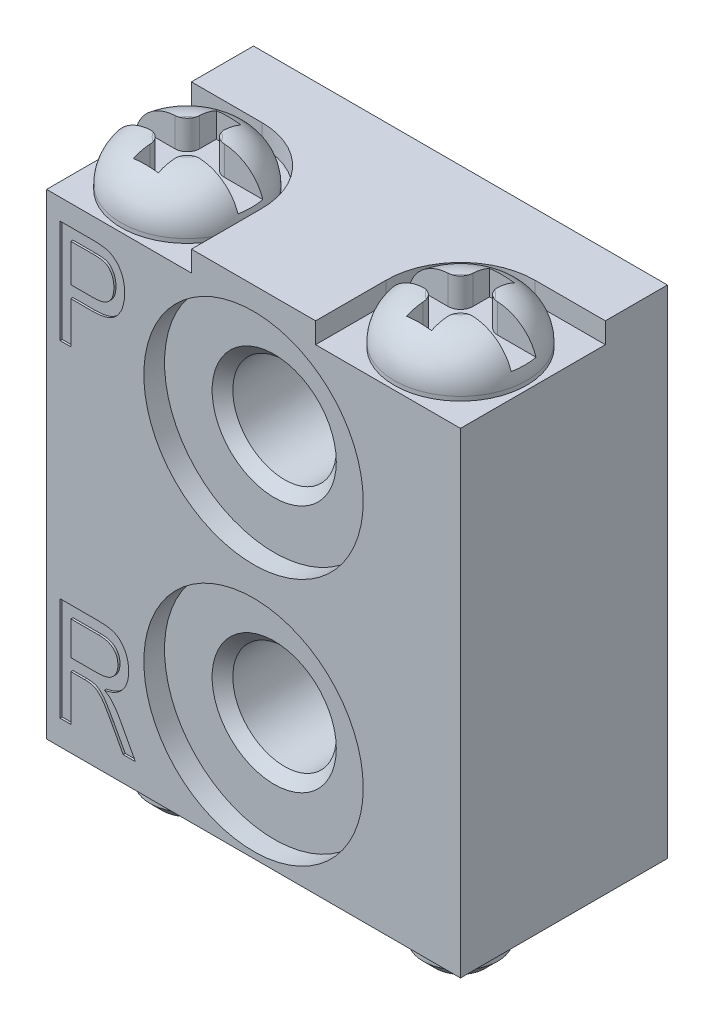
from build123d import *

# Parameters (mm, degrees)
SKETCH1_W                             = 10
SKETCH1_H                             = 12
BOSS_EXTRUDE1_DEPTH                   = 2.5
CUT_EXTRUDE1_DEPTH                    = 0.5
SKETCH3_R                             = 1.6
BOSS_EXTRUDE2_DEPTH                   = 1.1
FILLET1_R                             = 1
CUT_EXTRUDE2_DEPTH                    = 0.7
SKETCH5_R                             = 0.9
BOSS_EXTRUDE3_DEPTH                   = 1.2
CHAMFER1_SIZE                         = 0.3
SKETCH6_R                             = 2.65
CUT_EXTRUDE3_DEPTH                    = 0.5
TAP_DRILL_FOR_M3X0_5_TAP1_D           = 2.5
TAP_DRILL_FOR_M3X0_5_TAP1_DEPTH       = 3
TAP_DRILL_FOR_M3X0_5_TAP1_CSINK_D     = 3
TAP_DRILL_FOR_M3X0_5_TAP1_CSINK_ANGLE = 90
TAP_DRILL_FOR_M3X0_5_TAP1_TIP         = 0.751075774
CUT_EXTRUDE4_DEPTH                    = 0.05
SKETCH10_R                            = 0.85
CUT_EXTRUDE5_DEPTH                    = 1.5


with BuildPart() as part:
    # Sketch1 → Boss-Extrude1 (new, symmetric)
    with BuildSketch(Plane.XY):
        Rectangle(SKETCH1_W, SKETCH1_H)
    extrude(amount=BOSS_EXTRUDE1_DEPTH, both=True)

    # Sketch2 → Cut-Extrude1 (cut)
    with BuildSketch(Plane(origin=(0, 6, 0), x_dir=(1, 0, 0), z_dir=(0, 1, 0))):
        with BuildLine():
            Line((-5, -2.5), (-1.5, -2.5))
            Line((-1.5, -2.5), (-1.5, -0.8))
            ThreePointArc((-1.5, -0.8), (-2.027207794, 0.472792206), (-3.3, 1))
            Line((-3.3, 1), (-5, 1))
            Line((-5, 1), (-5, -2.5))
        make_face()
        with BuildLine():
            Line((5, -2.5), (1.5, -2.5))
            Line((1.5, -2.5), (1.5, -0.8))
            ThreePointArc((1.5, -0.8), (2.027207794, 0.472792206), (3.3, 1))
            Line((3.3, 1), (5, 1))
            Line((5, 1), (5, -2.5))
        make_face()
    extrude(amount=-CUT_EXTRUDE1_DEPTH, mode=Mode.SUBTRACT)

    # Sketch3 → Boss-Extrude2 (add)
    with BuildSketch(Plane(origin=(0, 5.5, 0), x_dir=(1, 0, 0), z_dir=(0, 1, 0))):
        with Locations(Location((-3.3, -0.8, 0), (0, 0, 90))):
            Circle(SKETCH3_R)
        with Locations(Location((3.3, -0.8, 0), (0, 0, 270))):
            Circle(SKETCH3_R)
    extrude(amount=BOSS_EXTRUDE2_DEPTH)

    # Fillet1
    fillet1_edges = [part.edges().sort_by_distance(p)[0] for p in [
        (-3.3, 6.6, 2.4),
        (3.3, 6.6, -0.8),
    ]]
    fillet(fillet1_edges, radius=FILLET1_R)

    # Sketch4 → Cut-Extrude2 (cut)
    with BuildSketch(Plane(origin=(0, 6.6, 0), x_dir=(1, 0, 0), z_dir=(0, 1, 0))):
        with BuildLine():
            Line((-2.7, -0.5), (-1.7, -0.5))
            Line((-1.7, -0.5), (-1.7, -1.1))
            Line((-1.7, -1.1), (-2.7, -1.1))
            ThreePointArc((-2.7, -1.1), (-2.912132034, -1.187867966), (-3, -1.4))
            Line((-3, -1.4), (-3, -1.8))
            Line((-3, -1.8), (-3.6, -1.8))
            Line((-3.6, -1.8), (-3.6, -1.4))
            ThreePointArc((-3.6, -1.4), (-3.687867966, -1.187867966), (-3.9, -1.1))
            Line((-3.9, -1.1), (-4.9, -1.1))
            Line((-4.9, -1.1), (-4.9, -0.5))
            Line((-4.9, -0.5), (-3.9, -0.5))
            ThreePointArc((-3.9, -0.5), (-3.687867966, -0.412132034), (-3.6, -0.2))
            Line((-3.6, -0.2), (-3.6, 0.2))
            Line((-3.6, 0.2), (-3, 0.2))
            Line((-3, 0.2), (-3, -0.2))
            ThreePointArc((-3, -0.2), (-2.912132034, -0.412132034), (-2.7, -0.5))
        make_face()
        with BuildLine():
            Line((3, -1.4), (3, -1.8))
            Line((3, -1.8), (3.6, -1.8))
            Line((3.6, -1.8), (3.6, -1.4))
            ThreePointArc((3.6, -1.4), (3.687867966, -1.187867966), (3.9, -1.1))
            Line((3.9, -1.1), (4.9, -1.1))
            Line((4.9, -1.1), (4.9, -0.5))
            Line((4.9, -0.5), (3.9, -0.5))
            ThreePointArc((3.9, -0.5), (3.687867966, -0.412132034), (3.6, -0.2))
            Line((3.6, -0.2), (3.6, 0.2))
            Line((3.6, 0.2), (3, 0.2))
            Line((3, 0.2), (3, -0.2))
            ThreePointArc((3, -0.2), (2.912132034, -0.412132034), (2.7, -0.5))
            Line((2.7, -0.5), (1.7, -0.5))
            Line((1.7, -0.5), (1.7, -1.1))
            Line((1.7, -1.1), (2.7, -1.1))
            ThreePointArc((2.7, -1.1), (2.912132034, -1.187867966), (3, -1.4))
        make_face()
    extrude(amount=-CUT_EXTRUDE2_DEPTH, mode=Mode.SUBTRACT)

    # Sketch5 → Boss-Extrude3 (add)
    with BuildSketch(Plane.XZ.offset(6)):
        with Locations(Location((-3.3, 0.8, 0), (0, 0, 90))):
            Circle(SKETCH5_R)
        with Locations(Location((3.3, 0.8, 0), (0, 0, 90))):
            Circle(SKETCH5_R)
    extrude(amount=BOSS_EXTRUDE3_DEPTH)

    # Chamfer1
    chamfer1_edges = [part.edges().sort_by_distance(p)[0] for p in [
        (-3.3, -7.2, -0.1),
        (3.3, -7.2, -0.1),
    ]]
    chamfer(chamfer1_edges, length=CHAMFER1_SIZE)

    # Sketch6 → Cut-Extrude3 (cut)
    with BuildSketch(Plane.XY.offset(2.5)):
        with Locations((0, 2.8)):
            Circle(SKETCH6_R)
        with Locations((0, -3.2)):
            Circle(SKETCH6_R)
    extrude(amount=-CUT_EXTRUDE3_DEPTH, mode=Mode.SUBTRACT)

    # Tap Drill for M3x0.5 Tap1
    with Locations(Plane.XY.offset(2)):
        with Locations((0, 2.8), (0, -3.2)):
            CounterSinkHole(TAP_DRILL_FOR_M3X0_5_TAP1_D / 2, TAP_DRILL_FOR_M3X0_5_TAP1_CSINK_D / 2, depth=TAP_DRILL_FOR_M3X0_5_TAP1_DEPTH, counter_sink_angle=TAP_DRILL_FOR_M3X0_5_TAP1_CSINK_ANGLE)
            with Locations((0, 0, -(TAP_DRILL_FOR_M3X0_5_TAP1_DEPTH + TAP_DRILL_FOR_M3X0_5_TAP1_TIP / 2))):  # 118° drill point
                Cone(0, TAP_DRILL_FOR_M3X0_5_TAP1_D / 2, TAP_DRILL_FOR_M3X0_5_TAP1_TIP, mode=Mode.SUBTRACT)

    # Sketch9 → Cut-Extrude4 (cut)
    # profile 1 of 2: a face of its own
    with BuildSketch(Plane.XY.offset(2.5)):
        with BuildLine():
            Line((-4.672727273, 2.5), (-4.672727273, 5))
            Line((-4.672727273, 5), (-3.902637987, 5))
            add(Edge.make_bspline(
                [(-3.902637987, 5), (-3.880650106, 5.000020633), (-3.838348709, 5.000060327), (-3.7771424, 4.997065844), (-3.720238235, 4.994039997), (-3.667835822, 4.988201441), (-3.619895513, 4.981825949), (-3.576466269, 4.973859003), (-3.537539421, 4.963790134), (-3.513325656, 4.955655561), (-3.501866883, 4.951806006)],
                knots=[0, 0, 0, 0, 1.301145482, 2.503209419, 3.626350361, 4.67304202, 5.622796861, 6.488461115, 7.284688674, 8, 8, 8, 8], degree=3))
            add(Edge.make_bspline(
                [(-3.501866883, 4.951806006), (-3.487357154, 4.946189951), (-3.45837208, 4.934971147), (-3.417544943, 4.91282294), (-3.378598648, 4.887870759), (-3.341974583, 4.859464535), (-3.307887547, 4.827166446), (-3.275803972, 4.791686147), (-3.246361278, 4.752294251), (-3.219233901, 4.709829763), (-3.193974117, 4.664721099), (-3.17311804, 4.616416656), (-3.154383081, 4.565934854), (-3.140128635, 4.51268443), (-3.128082272, 4.457042055), (-3.12040969, 4.39883909), (-3.114941134, 4.338071069), (-3.114507509, 4.296719175), (-3.114285714, 4.275568182)],
                knots=[0, 0, 0, 0, 0.897158766, 1.79219156, 2.674738776, 3.564969572, 4.462552928, 5.381685756, 6.322532571, 7.297145314, 8.28871417, 9.302465757, 10.330585605, 11.393732126, 12.480975679, 13.614163778, 14.779673607, 16, 16, 16, 16], degree=3))
            add(Edge.make_bspline(
                [(-3.114285714, 4.275568182), (-3.114715155, 4.24781553), (-3.115555042, 4.193537852), (-3.12380143, 4.11415012), (-3.137506661, 4.038879272), (-3.156205989, 3.967363706), (-3.18049149, 3.899711419), (-3.21056374, 3.836100193), (-3.245842024, 3.776302215), (-3.286117262, 3.720205908), (-3.333577765, 3.669144738), (-3.389590433, 3.62546228), (-3.4529638, 3.588102306), (-3.524488989, 3.558406971), (-3.603436396, 3.534421168), (-3.690521754, 3.518069718), (-3.785408578, 3.508599198), (-3.851208394, 3.507213394), (-3.88538961, 3.506493506)],
                knots=[0, 0, 0, 0, 1.066125632, 2.085091685, 3.062630143, 4.003547869, 4.922307223, 5.820454748, 6.703048758, 7.586837887, 8.469431897, 9.371589709, 10.306565591, 11.287746888, 12.340181319, 13.471797101, 14.68666727, 16, 16, 16, 16], degree=3))
            Line((-3.88538961, 3.506493506), (-4.412987013, 3.506493506))
            Line((-4.412987013, 3.506493506), (-4.412987013, 2.5))
            Line((-4.412987013, 2.5), (-4.672727273, 2.5))
        make_face()
        with BuildLine():
            Line((-4.412987013, 3.798701299), (-3.869155844, 3.798701299))
            add(Edge.make_bspline(
                [(-3.869155844, 3.798701299), (-3.848517733, 3.799164971), (-3.808531173, 3.800063341), (-3.750492349, 3.804855059), (-3.69673153, 3.813993945), (-3.647266128, 3.82650908), (-3.602233845, 3.842828857), (-3.561410032, 3.86245276), (-3.525027776, 3.886072359), (-3.492513946, 3.913069462), (-3.46480228, 3.944437097), (-3.439874401, 3.978605777), (-3.419658499, 4.01718889), (-3.403137857, 4.059270907), (-3.389718527, 4.104714628), (-3.380864358, 4.153872818), (-3.375204859, 4.206611625), (-3.374426744, 4.243085173), (-3.374025974, 4.261870942)],
                knots=[0, 0, 0, 0, 1.269306236, 2.459294321, 3.577321076, 4.618943517, 5.592639886, 6.518111891, 7.397820391, 8.253919533, 9.107995395, 9.965041305, 10.848919063, 11.777714976, 12.741869721, 13.757527659, 14.845010431, 16, 16, 16, 16], degree=3))
            add(Edge.make_bspline(
                [(-3.374025974, 4.261870942), (-3.374602958, 4.286272267), (-3.375719456, 4.333490235), (-3.387268193, 4.401408568), (-3.405132893, 4.464061645), (-3.431279037, 4.520189199), (-3.46185665, 4.569407574), (-3.49533893, 4.611510334), (-3.532734436, 4.644588229), (-3.567537291, 4.665204832), (-3.598101816, 4.678207291), (-3.625338973, 4.686231213), (-3.656790072, 4.692533795), (-3.692341599, 4.698052904), (-3.731924301, 4.702706598), (-3.77561371, 4.705448435), (-3.823475228, 4.707698412), (-3.856808152, 4.707760013), (-3.874228896, 4.707792208)],
                knots=[0, 0, 0, 0, 1.500314686, 2.903195123, 4.226916567, 5.498136997, 6.699407891, 7.786731959, 8.797026544, 9.75363827, 10.261964553, 10.838097333, 11.497334866, 12.234733717, 13.051831226, 13.948971176, 14.928073425, 16, 16, 16, 16], degree=3))
            Line((-3.874228896, 4.707792208), (-4.412987013, 4.707792208))
            Line((-4.412987013, 4.707792208), (-4.412987013, 3.798701299))
        make_face(mode=Mode.SUBTRACT)
    # profile 2 of 2: a face of its own
    with BuildSketch(Plane.XY.offset(2.5)):
        with BuildLine():
            Line((-4.672727273, -5.4), (-4.672727273, -2.9))
            Line((-4.672727273, -2.9), (-3.75450487, -2.9))
            add(Edge.make_bspline(
                [(-3.75450487, -2.9), (-3.731332497, -2.900133383), (-3.686479982, -2.900391559), (-3.621504618, -2.904105574), (-3.561087686, -2.909603488), (-3.505309679, -2.916913571), (-3.454496211, -2.927048237), (-3.408445773, -2.939342314), (-3.366783725, -2.953065075), (-3.317874056, -2.975700894), (-3.262074321, -3.010811293), (-3.201894347, -3.064303758), (-3.149181597, -3.130547273), (-3.102275066, -3.206658455), (-3.063753973, -3.292113294), (-3.036467761, -3.385306986), (-3.019995612, -3.485015082), (-3.01793866, -3.553682929), (-3.016883117, -3.588920455)],
                knots=[0, 0, 0, 0, 0.957775898, 1.853873864, 2.6892683, 3.465319774, 4.178195347, 4.829309051, 5.435011313, 5.988660553, 7.053440284, 8.147710094, 9.30058322, 10.540256924, 11.835580405, 13.162637032, 14.543981594, 16, 16, 16, 16], degree=3))
            add(Edge.make_bspline(
                [(-3.016883117, -3.588920455), (-3.017435012, -3.61227146), (-3.018513035, -3.657883273), (-3.025043411, -3.724735292), (-3.036391698, -3.788147944), (-3.053746954, -3.847957145), (-3.073874796, -3.904906125), (-3.100305243, -3.957996601), (-3.130629145, -4.007914236), (-3.165874125, -4.054262266), (-3.205296929, -4.096937341), (-3.249540812, -4.13526866), (-3.297745493, -4.169800514), (-3.350286835, -4.200229694), (-3.406839666, -4.2269457), (-3.468072927, -4.24826394), (-3.533032283, -4.266932881), (-3.578217067, -4.275495902), (-3.601298701, -4.27987013)],
                knots=[0, 0, 0, 0, 1.121977975, 2.191573688, 3.224240956, 4.211948119, 5.180998842, 6.122125515, 7.055751929, 7.983633331, 8.914994346, 9.842128418, 10.791356962, 11.759862547, 12.75578979, 13.791489111, 14.871831714, 16, 16, 16, 16], degree=3))
            add(Edge.make_bspline(
                [(-3.601298701, -4.27987013), (-3.584262108, -4.289296064), (-3.551831047, -4.307239384), (-3.507447956, -4.336189213), (-3.469517511, -4.365328643), (-3.448075079, -4.386533769), (-3.437946429, -4.396550325)],
                knots=[0, 0, 0, 0, 1.158843086, 2.205987482, 3.152571606, 4, 4, 4, 4], degree=3))
            add(Edge.make_bspline(
                [(-3.437946429, -4.396550325), (-3.417687737, -4.42100338), (-3.376942544, -4.470184463), (-3.321087369, -4.548646714), (-3.267585469, -4.630269403), (-3.236166635, -4.687686756), (-3.2203125, -4.716659903)],
                knots=[0, 0, 0, 0, 0.982253192, 1.975551771, 2.978451105, 4, 4, 4, 4], degree=3))
            Line((-3.2203125, -4.716659903), (-2.854545455, -5.4))
            Line((-2.854545455, -5.4), (-3.149797078, -5.4))
            Line((-3.149797078, -5.4), (-3.438453734, -4.865300325))
            add(Edge.make_bspline(
                [(-3.438453734, -4.865300325), (-3.45190067, -4.840228961), (-3.477621448, -4.792273427), (-3.515793751, -4.724183639), (-3.55127758, -4.662776739), (-3.584013009, -4.607992836), (-3.614485165, -4.56041313), (-3.641853599, -4.519383809), (-3.666917998, -4.485372113), (-3.696916116, -4.450329794), (-3.731784054, -4.414004846), (-3.773233554, -4.377523213), (-3.814634913, -4.34924191), (-3.856787169, -4.327704783), (-3.903187751, -4.313516761), (-3.955472075, -4.302896844), (-4.015978852, -4.297120412), (-4.058876772, -4.296457074), (-4.081716721, -4.296103896)],
                knots=[0, 0, 0, 0, 1.483643366, 2.83785556, 4.070616892, 5.1822306, 6.165666296, 7.016844219, 7.754091418, 8.367230408, 9.421242841, 10.377779407, 11.241203819, 12.029974219, 12.835959019, 13.762973995, 14.808950166, 16, 16, 16, 16], degree=3))
            Line((-4.081716721, -4.296103896), (-4.412987013, -4.296103896))
            Line((-4.412987013, -4.296103896), (-4.412987013, -5.4))
            Line((-4.412987013, -5.4), (-4.672727273, -5.4))
        make_face()
        with BuildLine():
            Line((-4.412987013, -4.003896104), (-3.803713474, -4.003896104))
            add(Edge.make_bspline(
                [(-3.803713474, -4.003896104), (-3.772413379, -4.003286375), (-3.713753945, -4.002143685), (-3.631689415, -3.994554562), (-3.561644989, -3.980821109), (-3.502312302, -3.960818962), (-3.451718544, -3.934315441), (-3.407670049, -3.901494982), (-3.369033719, -3.862297904), (-3.336169395, -3.816959314), (-3.308996241, -3.766469328), (-3.290656556, -3.710966313), (-3.278208314, -3.652041436), (-3.277160291, -3.611309723), (-3.276623377, -3.59044237)],
                knots=[0, 0, 0, 0, 1.47306528, 2.760668081, 3.873497699, 4.82484281, 5.696997418, 6.550136397, 7.399890849, 8.276969651, 9.17766846, 10.086208714, 11.019541422, 12, 12, 12, 12], degree=3))
            add(Edge.make_bspline(
                [(-3.276623377, -3.59044237), (-3.277092305, -3.575382475), (-3.278006493, -3.546022815), (-3.282816425, -3.503131155), (-3.292203992, -3.462768937), (-3.304590307, -3.424719264), (-3.321242988, -3.389329762), (-3.340689381, -3.356041804), (-3.365179868, -3.326223985), (-3.391831229, -3.297995415), (-3.422674254, -3.272934889), (-3.457117734, -3.251220507), (-3.495154727, -3.232980032), (-3.536420045, -3.217339579), (-3.581751224, -3.206936092), (-3.630085875, -3.197925563), (-3.682024844, -3.192930022), (-3.717800151, -3.192453456), (-3.736241883, -3.192207792)],
                knots=[0, 0, 0, 0, 1.045235731, 2.037714497, 2.988326782, 3.915852726, 4.808207886, 5.697550021, 6.58254782, 7.478674216, 8.387536059, 9.331464042, 10.296946822, 11.310355404, 12.385965615, 13.518246496, 14.720686494, 16, 16, 16, 16], degree=3))
            Line((-3.736241883, -3.192207792), (-4.412987013, -3.192207792))
            Line((-4.412987013, -3.192207792), (-4.412987013, -4.003896104))
        make_face(mode=Mode.SUBTRACT)
    extrude(amount=-CUT_EXTRUDE4_DEPTH, mode=Mode.SUBTRACT)

    # Sketch10 → Cut-Extrude5 (cut)
    with BuildSketch(Plane(origin=(0, 0, -2.5), x_dir=(-1, 0, 0), z_dir=(0, 0, -1))):
        with Locations((-3.3, -0.5)):
            Circle(SKETCH10_R)
        with Locations((3.3, -0.5)):
            Circle(SKETCH10_R)
    extrude(amount=-CUT_EXTRUDE5_DEPTH, mode=Mode.SUBTRACT)


solid = part.part
